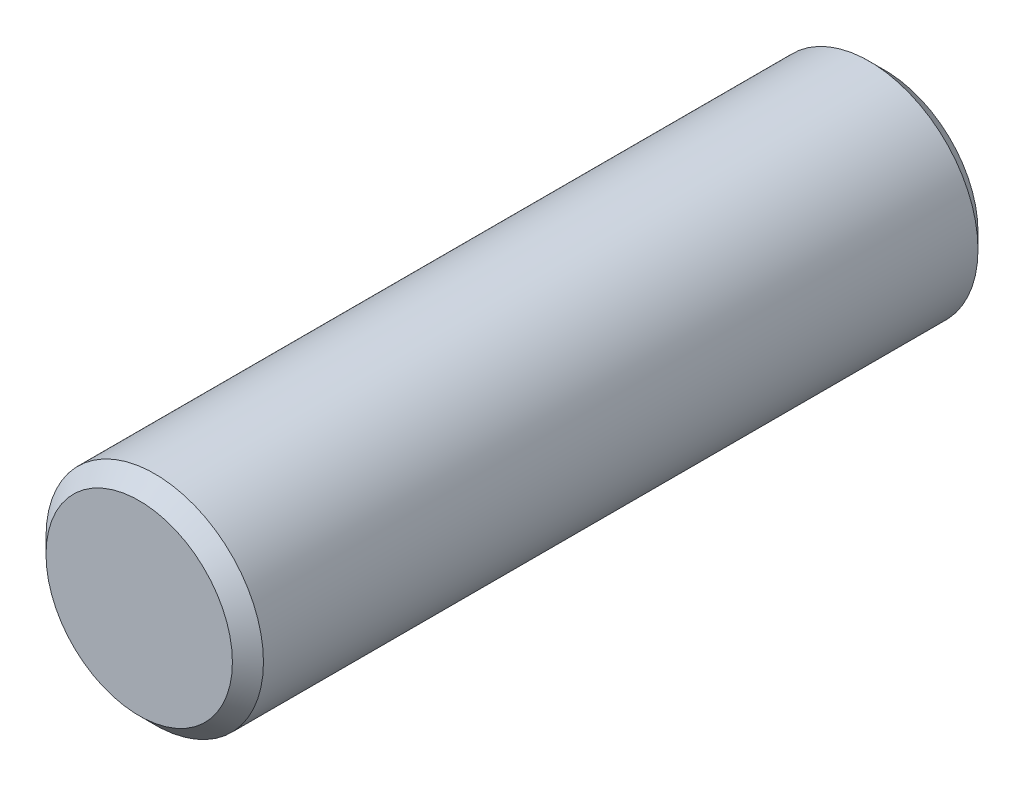
from build123d import *

# Parameters (mm, degrees)
SKETCH_1_R      = 3.5
EXTRUDE_1_DEPTH = 24
CHAMFER_1_SIZE  = 0.5


with BuildPart() as part:
    # 스케치1 → 보스-돌출1 (new body)
    with BuildSketch(Plane.XY):
        Circle(SKETCH_1_R)
    extrude(amount=EXTRUDE_1_DEPTH)

    # 모따기1
    chamfer_1_edges = [part.edges().sort_by_distance(p)[0] for p in [
        (-3.5, 0, 0),
        (-3.5, 0, 24),
    ]]
    chamfer(chamfer_1_edges, length=CHAMFER_1_SIZE)


solid = part.part
